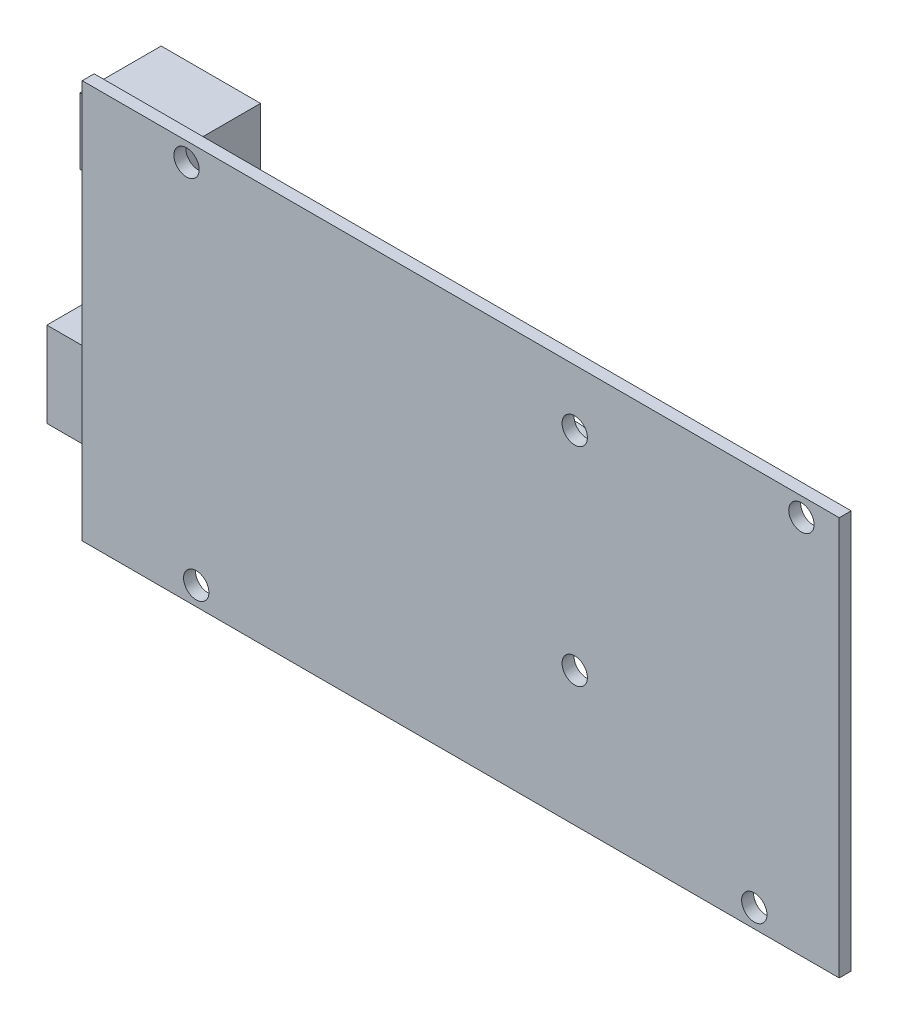
from build123d import *

# Parameters (mm, degrees)
SKETCH1_W            = 101.6
SKETCH1_H            = 53.5
BOSS_EXTRUDE1_DEPTH  = 1.6
M3_CLEARANCE_HOLE1_D = 3.4
SKETCH5_W            = 15.875
SKETCH5_H            = 11.43
BOSS_EXTRUDE2_DEPTH  = 10.9
SKETCH6_W            = 13.335
SKETCH6_H            = 8.89
BOSS_EXTRUDE3_DEPTH  = 10.9
SKETCH7_R            = 4.658430909
BOSS_EXTRUDE4_DEPTH  = 14


with BuildPart() as part:
    # Sketch1 → Boss-Extrude1 (new body)
    with BuildSketch(Plane.XY):
        Rectangle(SKETCH1_W, SKETCH1_H)
    extrude(amount=BOSS_EXTRUDE1_DEPTH)

    # M3 Clearance Hole1 (through all)
    with Locations(Plane(origin=(0, 0, 0), x_dir=(-1, 0, 0), z_dir=(0, 0, -1))):
        with Locations((-15.3, 19.15), (-45.72, 24.25), (-15.3, -8.75), (-39.4, -24.25), (35.5, -24.25), (36.8, 24.25)):
            Hole(M3_CLEARANCE_HOLE1_D / 2)

    # Sketch5 → Boss-Extrude2 (add)
    with BuildSketch(Plane(origin=(0, 0, 0), x_dir=(-1, 0, 0), z_dir=(0, 0, -1))):
        with Locations((49.2125, -11.35)):
            Rectangle(SKETCH5_W, SKETCH5_H)
    extrude(amount=BOSS_EXTRUDE2_DEPTH)

    # Sketch6 → Boss-Extrude3 (add)
    with BuildSketch(Plane(origin=(0, 0, 0), x_dir=(-1, 0, 0), z_dir=(0, 0, -1))):
        with Locations((46.0375, 19.13)):
            Rectangle(SKETCH6_W, SKETCH6_H)
    extrude(amount=BOSS_EXTRUDE3_DEPTH)

    # Sketch7 → Boss-Extrude4 (add)
    with BuildSketch(Plane(origin=(0, 0, 0), x_dir=(-1, 0, 0), z_dir=(0, 0, -1))):
        Circle(SKETCH7_R)
    extrude(amount=BOSS_EXTRUDE4_DEPTH)


solid = part.part
